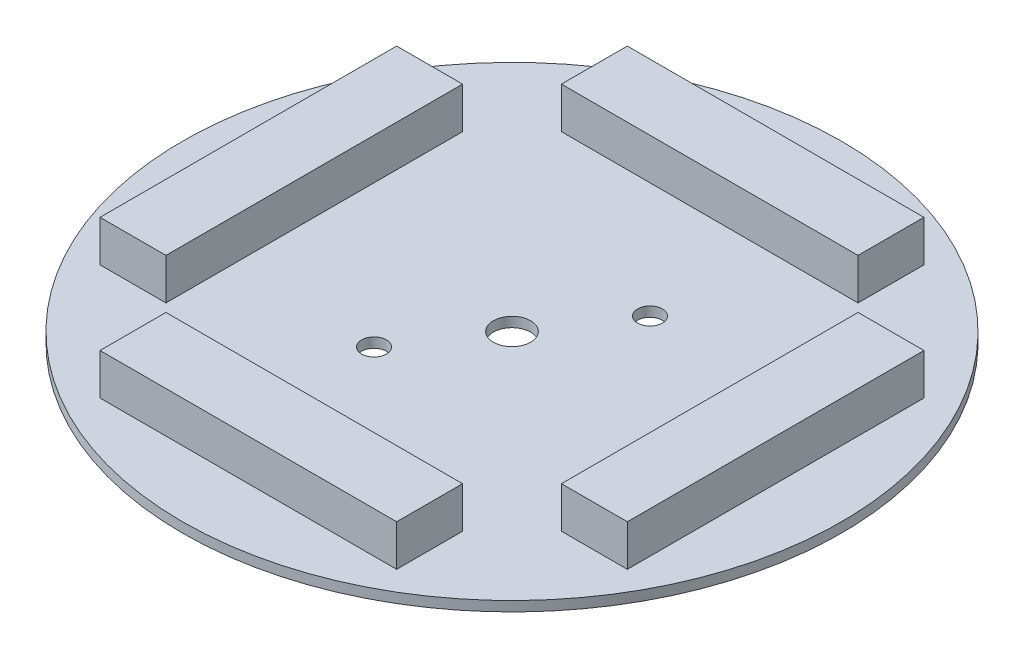
from build123d import *

# Parameters (mm, degrees)
SKETCH1_R                    = 20
SKETCH1_R_2                  = 1.1303
SKETCH1_R_3                  = 0.75
PCB_DEPTH                    = 0.6
SKETCH2_W                    = 18
SKETCH2_H                    = 4
HIROSE_CONNECTOR_STACK_DEPTH = 2.5
CIRPATTERN1_COUNT            = 4


with BuildPart() as part:
    # Sketch1 → PCB (new body)
    with BuildSketch(Plane(origin=(0, 0, 0), x_dir=(1, 0, 0), z_dir=(0, 1, 0))):
        with Locations(Location((0, 0, 0), (0, 0, 270))):
            Circle(SKETCH1_R)
        with Locations(Location((0, 0, 0), (0, 0, 270))):
            Circle(SKETCH1_R_2, mode=Mode.SUBTRACT)
        with Locations(Location((3.372542584, 5, 0), (0, 0, 270))):
            Circle(SKETCH1_R_3, mode=Mode.SUBTRACT)
        with Locations(Location((-3.372542584, -5, 0), (0, 0, 270))):
            Circle(SKETCH1_R_3, mode=Mode.SUBTRACT)
    extrude(amount=PCB_DEPTH)

    # Sketch2 → Hirose Connector Stack (add)
    with BuildSketch(Plane(origin=(0, 0.6, 0), x_dir=(1, 0, 0), z_dir=(0, 1, 0))):
        with Locations((0, 14)):
            Rectangle(SKETCH2_W, SKETCH2_H)
    hirose_connector_stack = extrude(amount=HIROSE_CONNECTOR_STACK_DEPTH)

    # CirPattern1: Hirose Connector Stack ×4 about axis
    cirpattern1_axis = Axis((0, 0, 0), (0, 1, 0))
    for i in range(1, CIRPATTERN1_COUNT):
        add(hirose_connector_stack.rotate(cirpattern1_axis, i * 360 / CIRPATTERN1_COUNT))


solid = part.part
